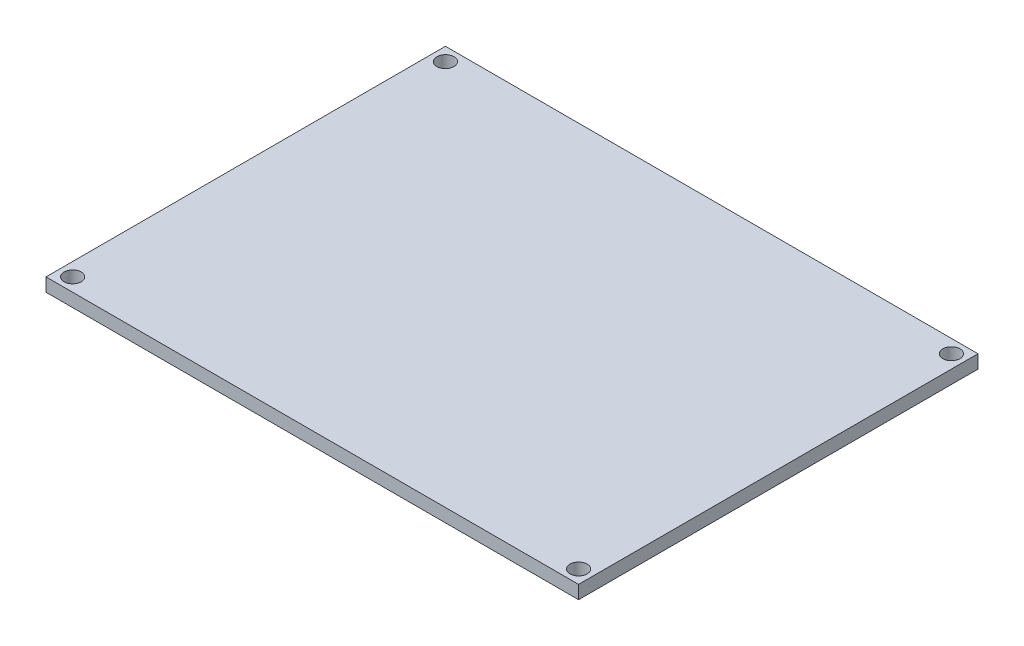
from build123d import *

# Parameters (mm, degrees)
SKETCH1_W                 = 101.6
SKETCH1_H                 = 76.2
BOSS_EXTRUDE1_DEPTH       = 2.54
F_4_CLEARANCE_HOLE1_D     = 3.2639
F_4_CLEARANCE_HOLE1_DEPTH = 10.16
F_4_CLEARANCE_HOLE1_TIP   = 0.980574487


with BuildPart() as part:
    # Sketch1 → Boss-Extrude1 (new body)
    with BuildSketch(Plane(origin=(0, 0, 0), x_dir=(1, 0, 0), z_dir=(0, 1, 0))):
        with Locations((50.8, 38.1)):
            Rectangle(SKETCH1_W, SKETCH1_H)
    extrude(amount=BOSS_EXTRUDE1_DEPTH)

    # #4 Clearance Hole1
    with Locations(Plane(origin=(0, 2.54, 0), x_dir=(1, 0, 0), z_dir=(0, 1, 0))):
        with Locations((2.54, 73.66), (2.54, 2.54), (99.06, 73.66), (99.06, 2.54)):
            Hole(F_4_CLEARANCE_HOLE1_D / 2, depth=F_4_CLEARANCE_HOLE1_DEPTH)
            with Locations((0, 0, -(F_4_CLEARANCE_HOLE1_DEPTH + F_4_CLEARANCE_HOLE1_TIP / 2))):  # 118° drill point
                Cone(0, F_4_CLEARANCE_HOLE1_D / 2, F_4_CLEARANCE_HOLE1_TIP, mode=Mode.SUBTRACT)


solid = part.part
